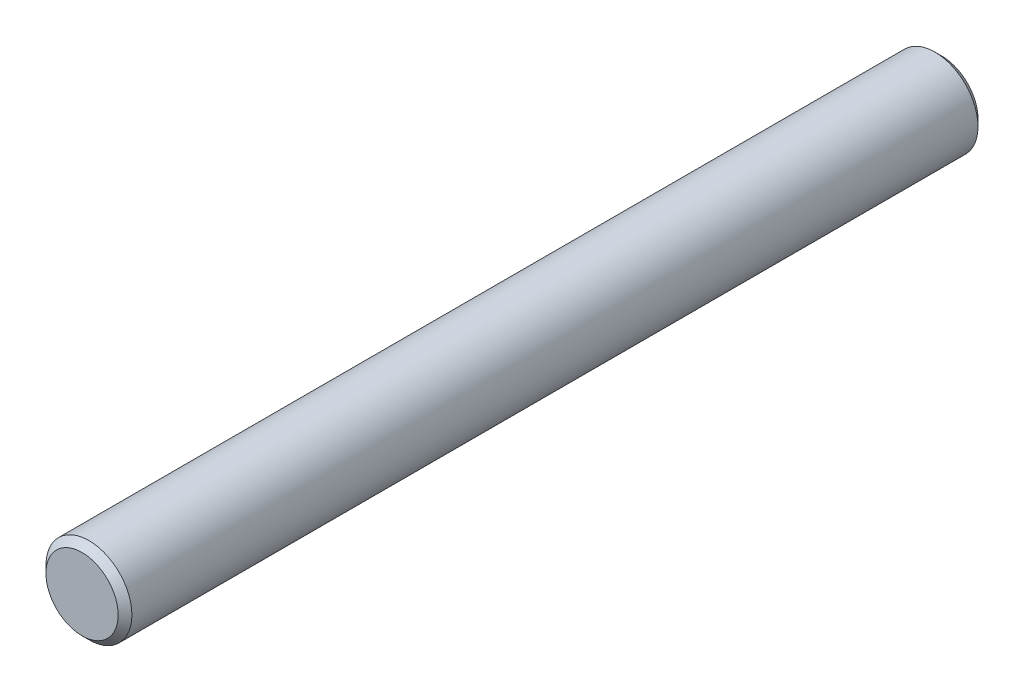
from build123d import *

# Parameters (mm, degrees)
SKETCH1_R           = 1.5875
BOSS_EXTRUDE1_DEPTH = 15.875
CHAMFER1_SIZE       = 0.254


with BuildPart() as part:
    # Sketch1 → Boss-Extrude1 (new, symmetric)
    with BuildSketch(Plane.XY):
        Circle(SKETCH1_R)
    extrude(amount=BOSS_EXTRUDE1_DEPTH, both=True)

    # Chamfer1
    chamfer1_edges = [part.edges().sort_by_distance(p)[0] for p in [
        (-1.5875, 0, -15.875),
        (-1.5875, 0, 15.875),
    ]]
    chamfer(chamfer1_edges, length=CHAMFER1_SIZE)


solid = part.part
